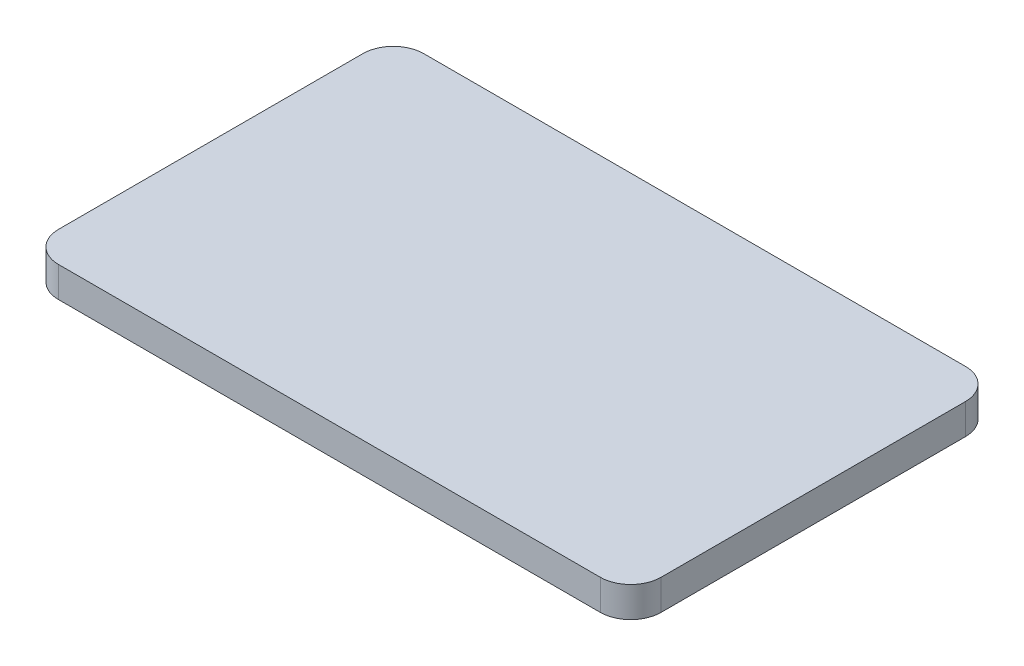
from build123d import *

# Parameters (mm, degrees)
BOSS_EXTRUDE1_DEPTH = 5


with BuildPart() as part:
    # Sketch2 → Boss-Extrude1 (new body)
    with BuildSketch(Plane(origin=(0, 0, 0), x_dir=(1, 0, 0), z_dir=(0, 1, 0))):
        with BuildLine():
            Line((44.5, 30), (-44.5, 30))
            ThreePointArc((-44.5, 30), (-48.035533906, 28.535533906), (-49.5, 25))
            Line((-49.5, 25), (-49.5, -25))
            ThreePointArc((-49.5, -25), (-48.035533906, -28.535533906), (-44.5, -30))
            Line((-44.5, -30), (44.5, -30))
            ThreePointArc((44.5, -30), (48.035533906, -28.535533906), (49.5, -25))
            Line((49.5, -25), (49.5, 25))
            ThreePointArc((49.5, 25), (48.035533906, 28.535533906), (44.5, 30))
        make_face()
    extrude(amount=BOSS_EXTRUDE1_DEPTH)


solid = part.part
